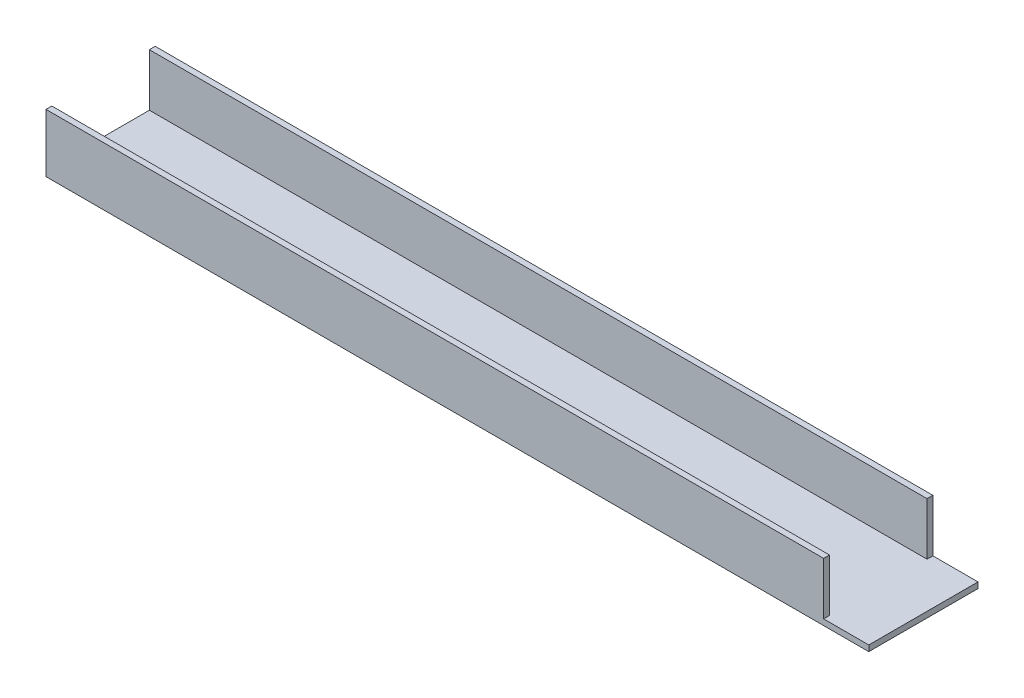
from build123d import *

# Parameters (mm, degrees)
SKETCH_1_W      = 565
SKETCH_1_H      = 75
EXTRUDE_1_DEPTH = 4
SKETCH_2_W      = 534
SKETCH_2_H      = 4
EXTRUDE_2_DEPTH = 36


with BuildPart() as part:
    # 스케치1 → 보스-돌출1 (new body)
    with BuildSketch(Plane(origin=(0, 0, 0), x_dir=(1, 0, 0), z_dir=(0, 1, 0))):
        with Locations((282.5, 37.5)):
            Rectangle(SKETCH_1_W, SKETCH_1_H)
    extrude(amount=EXTRUDE_1_DEPTH)

    # 스케치2 → 보스-돌출2 (add)
    with BuildSketch(Plane(origin=(0, 4, 0), x_dir=(1, 0, 0), z_dir=(0, 1, 0))):
        with Locations((267, 2)):
            Rectangle(SKETCH_2_W, SKETCH_2_H)
        with Locations((267, 73)):
            Rectangle(SKETCH_2_W, SKETCH_2_H)
    extrude(amount=EXTRUDE_2_DEPTH)


solid = part.part
